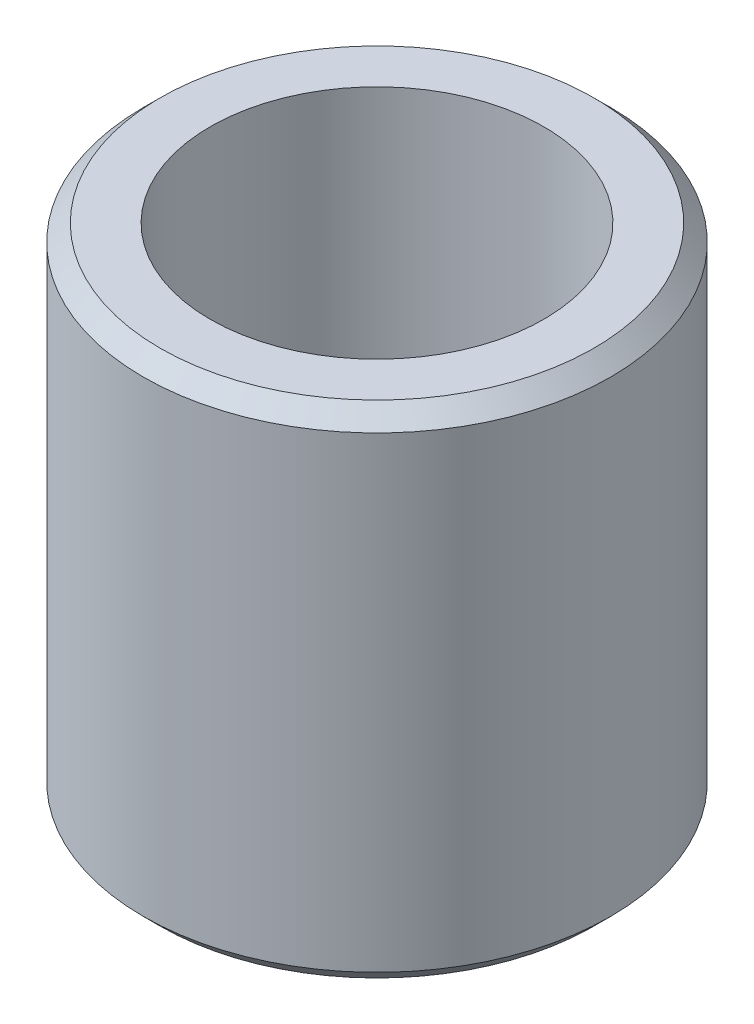
from build123d import *

# Parameters (mm, degrees)
SKETCH_1_R      = 7
SKETCH_1_R_2    = 5
EXTRUDE_1_DEPTH = 7.5
CHAMFER_1_SIZE  = 0.5


with BuildPart() as part:
    # 草图1 → 凸台-拉伸1 (new, symmetric)
    with BuildSketch(Plane(origin=(0, 0, 0), x_dir=(1, 0, 0), z_dir=(0, 1, 0))):
        with Locations(Location((0, 0, 0), (0, 0, 270))):
            Circle(SKETCH_1_R)
        with Locations(Location((0, 0, 0), (0, 0, 270))):
            Circle(SKETCH_1_R_2, mode=Mode.SUBTRACT)
    extrude(amount=EXTRUDE_1_DEPTH, both=True)

    # 倒角1
    chamfer_1_edges = [part.edges().sort_by_distance(p)[0] for p in [
        (0, -7.5, -7),
        (0, 7.5, -7),
    ]]
    chamfer(chamfer_1_edges, length=CHAMFER_1_SIZE)


solid = part.part
